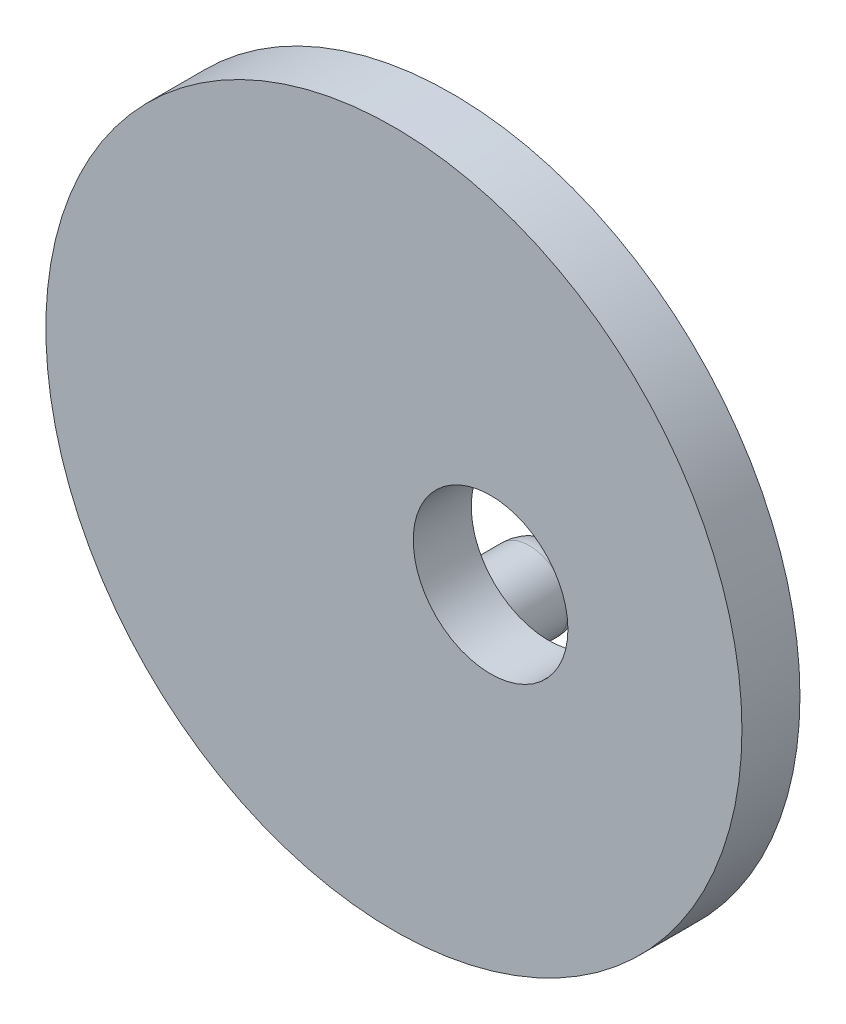
from build123d import *

# Parameters (mm, degrees)
SKETCH_2_R      = 9
SKETCH_2_R_2    = 2
EXTRUDE_1_DEPTH = 1.5
SKETCH_2_3_R    = 1
EXTRUDE_3_DEPTH = 3
FILLET_1_R      = 1


with BuildPart() as part:
    # 草图2 → 凸台-拉伸1 (new body)
    with BuildSketch(Plane.XY):
        Circle(SKETCH_2_R)
        with Locations((2.5, 0)):
            Circle(SKETCH_2_R_2, mode=Mode.SUBTRACT)
    extrude(amount=EXTRUDE_1_DEPTH)

    # 草图2<3> → 凸台-拉伸3 (add)
    with BuildSketch(Plane.XY):
        with Locations((-0.001510054, -3.123707411)):
            Circle(SKETCH_2_3_R)
        with Locations((-0.001510054, 3.123707411)):
            Circle(SKETCH_2_3_R)
    extrude(amount=-EXTRUDE_3_DEPTH)

    # 圆角1
    fillet_1_edges = [part.edges().sort_by_distance(p)[0] for p in [
        (-1.001510054, -3.123707411, -3),
        (-1.001510054, 3.123707411, -3),
    ]]
    fillet(fillet_1_edges, radius=FILLET_1_R)


solid = part.part
